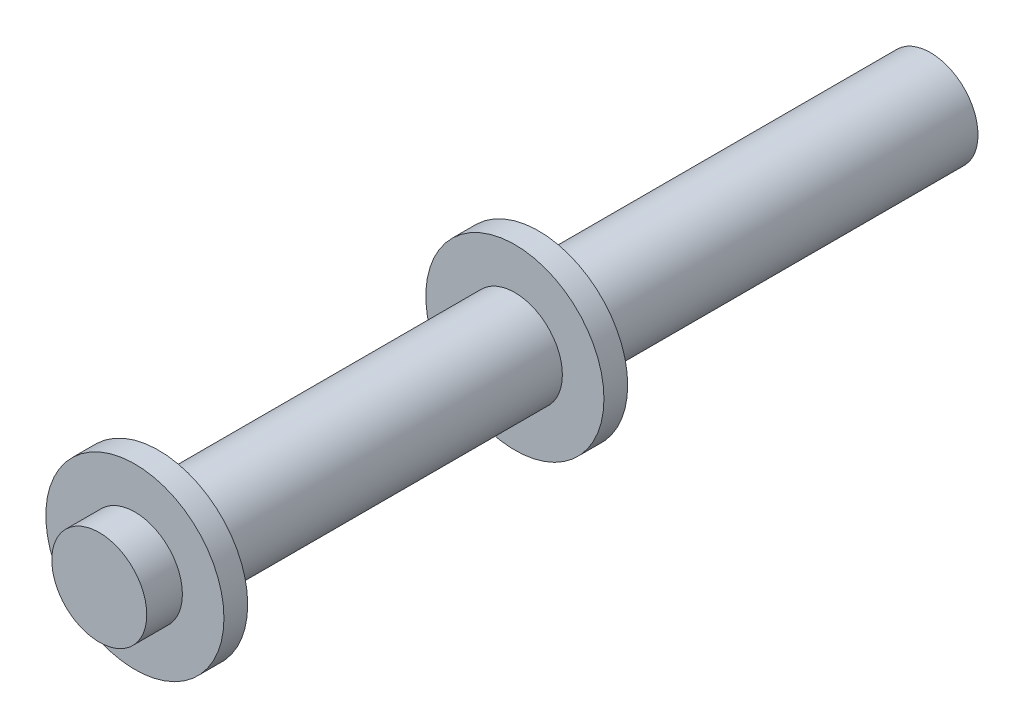
from build123d import *

# Parameters (mm, degrees)
SKETCH1_R           = 10.16
BOSS_EXTRUDE1_DEPTH = 177.8
BOSS_EXTRUDE2_START = -12.7
SKETCH2_R           = 19.05
BOSS_EXTRUDE2_DEPTH = 5.08
BOSS_EXTRUDE3_START = -93.98
SKETCH3_R           = 19.05
BOSS_EXTRUDE3_DEPTH = 5.08


with BuildPart() as part:
    # Sketch1 → Boss-Extrude1 (new body)
    with BuildSketch(Plane.XY):
        Circle(SKETCH1_R)
    extrude(amount=BOSS_EXTRUDE1_DEPTH)

    # Sketch2 → Boss-Extrude2 (add)
    with BuildSketch(Plane.XY.offset(177.8).offset(BOSS_EXTRUDE2_START)):
        Circle(SKETCH2_R)
    extrude(amount=BOSS_EXTRUDE2_DEPTH)

    # Sketch3 → Boss-Extrude3 (add)
    with BuildSketch(Plane.XY.offset(177.8).offset(BOSS_EXTRUDE3_START)):
        Circle(SKETCH3_R)
    extrude(amount=BOSS_EXTRUDE3_DEPTH)


solid = part.part
